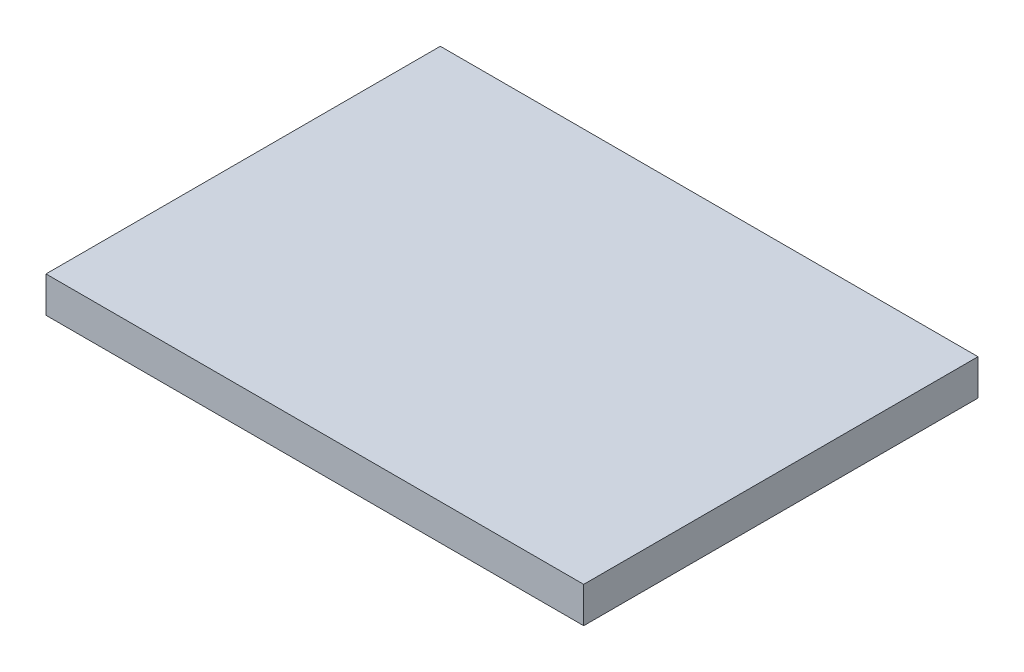
from build123d import *

# Parameters (mm, degrees)
SKETCH1_W           = 150
SKETCH1_H           = 110
BOSS_EXTRUDE1_DEPTH = 10


with BuildPart() as part:
    # Sketch1 → Boss-Extrude1 (new body)
    with BuildSketch(Plane(origin=(0, 0, 0), x_dir=(1, 0, 0), z_dir=(0, 1, 0))):
        with Locations((75, 55)):
            Rectangle(SKETCH1_W, SKETCH1_H)
    extrude(amount=BOSS_EXTRUDE1_DEPTH)


solid = part.part
